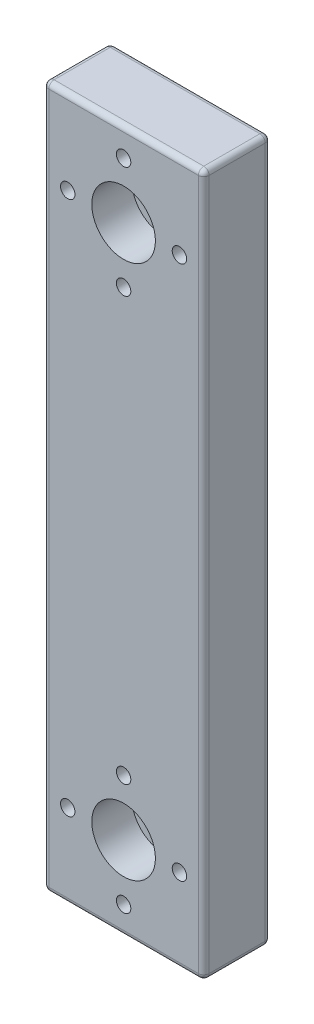
from build123d import *

# Parameters (mm, degrees)
SKETCH1_W           = 333.502
SKETCH1_H           = 76.2
BOSS_EXTRUDE1_DEPTH = 31.75
SKETCH2_R           = 15.113
CUT_EXTRUDE1_DEPTH  = 19.05
SKETCH3_R           = 10.287
CUT_EXTRUDE2_DEPTH  = 173.105806122
SKETCH4_R           = 3.429
CUT_EXTRUDE3_DEPTH  = 174.970021846
FILLET1_R           = 2.54


with BuildPart() as part:
    # Sketch1 → Boss-Extrude1 (new body)
    with BuildSketch(Plane(origin=(0, 0, 0), x_dir=(0, 1, 0), z_dir=(0, 0, 1))):
        Rectangle(SKETCH1_W, SKETCH1_H)
    extrude(amount=BOSS_EXTRUDE1_DEPTH)

    # Sketch2 → Cut-Extrude1 (cut)
    with BuildSketch(Plane.XY.offset(31.75)):
        with Locations((0, 127)):
            Circle(SKETCH2_R)
        with Locations((0, -127)):
            Circle(SKETCH2_R)
    extrude(amount=-CUT_EXTRUDE1_DEPTH, mode=Mode.SUBTRACT)

    # Sketch3 → Cut-Extrude2 (cut, through all)
    with BuildSketch(Plane.XY.offset(12.7)):
        with Locations((0, -127)):
            Circle(SKETCH3_R)
        with Locations((0, 127)):
            Circle(SKETCH3_R)
    extrude(amount=-CUT_EXTRUDE2_DEPTH, mode=Mode.SUBTRACT)

    # Sketch4 → Cut-Extrude3 (cut, through all)
    with BuildSketch(Plane.XY.offset(31.75)):
        with Locations((-26.543, 127)):
            Circle(SKETCH4_R)
        with Locations((0, 153.543)):
            Circle(SKETCH4_R)
        with Locations((26.543, 127)):
            Circle(SKETCH4_R)
        with Locations((0, 100.457)):
            Circle(SKETCH4_R)
        with Locations((0, -100.457)):
            Circle(SKETCH4_R)
        with Locations((26.543, -127)):
            Circle(SKETCH4_R)
        with Locations((0, -153.543)):
            Circle(SKETCH4_R)
        with Locations((-26.543, -127)):
            Circle(SKETCH4_R)
    extrude(amount=-CUT_EXTRUDE3_DEPTH, mode=Mode.SUBTRACT)

    # Fillet1
    fillet1_edges = [part.edges().sort_by_distance(p)[0] for p in [
        (0, -166.751, 31.75),
        (38.1, 0, 31.75),
        (0, 166.751, 31.75),
        (38.1, 0, 0),
        (0, -166.751, 0),
        (-38.1, 0, 0),
        (0, 166.751, 0),
        (38.1, 166.751, 15.875),
        (38.1, -166.751, 15.875),
        (-38.1, -166.751, 15.875),
        (-38.1, 166.751, 15.875),
        (-38.1, 0, 31.75),
    ]]
    fillet(fillet1_edges, radius=FILLET1_R)


solid = part.part
